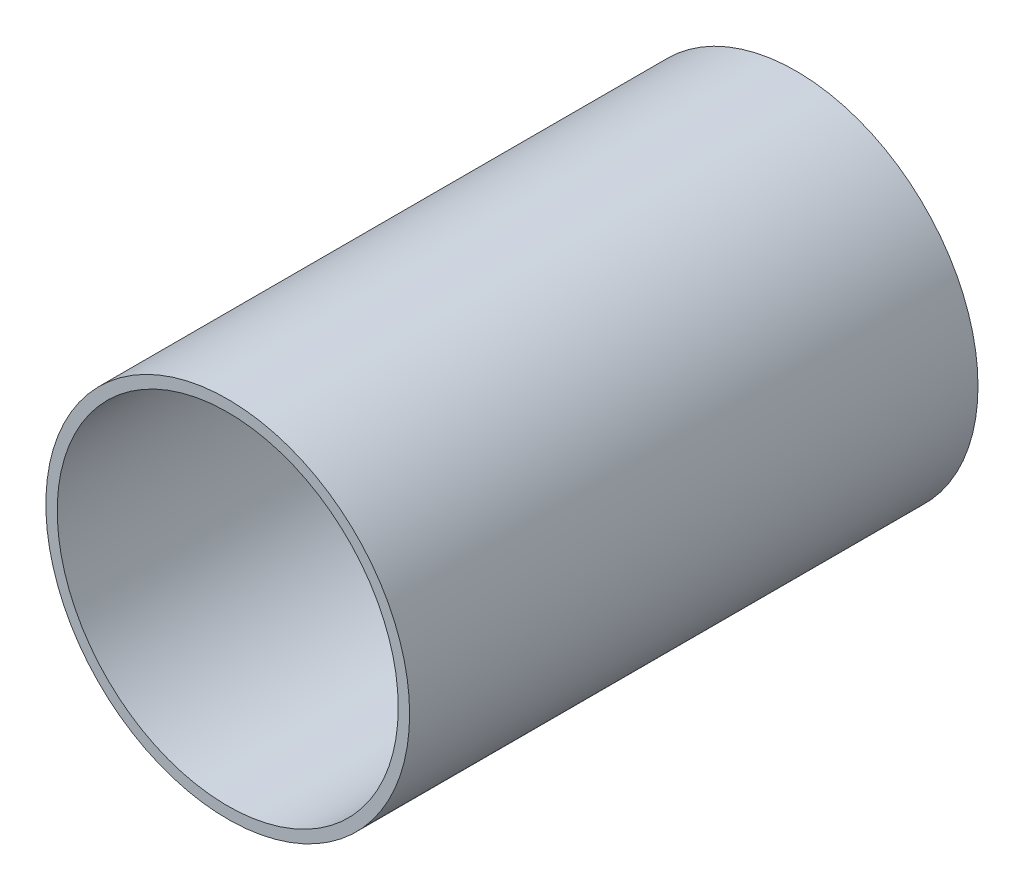
from build123d import *

# Parameters (mm, degrees)
SKETCH_1_R      = 32
SKETCH_1_R_2    = 30
EXTRUDE_1_DEPTH = 100


with BuildPart() as part:
    # 草图1 → 拉伸-薄壁1 (new body)
    with BuildSketch(Plane.XY):
        Circle(SKETCH_1_R)
        Circle(SKETCH_1_R_2, mode=Mode.SUBTRACT)
    extrude(amount=EXTRUDE_1_DEPTH)


solid = part.part
